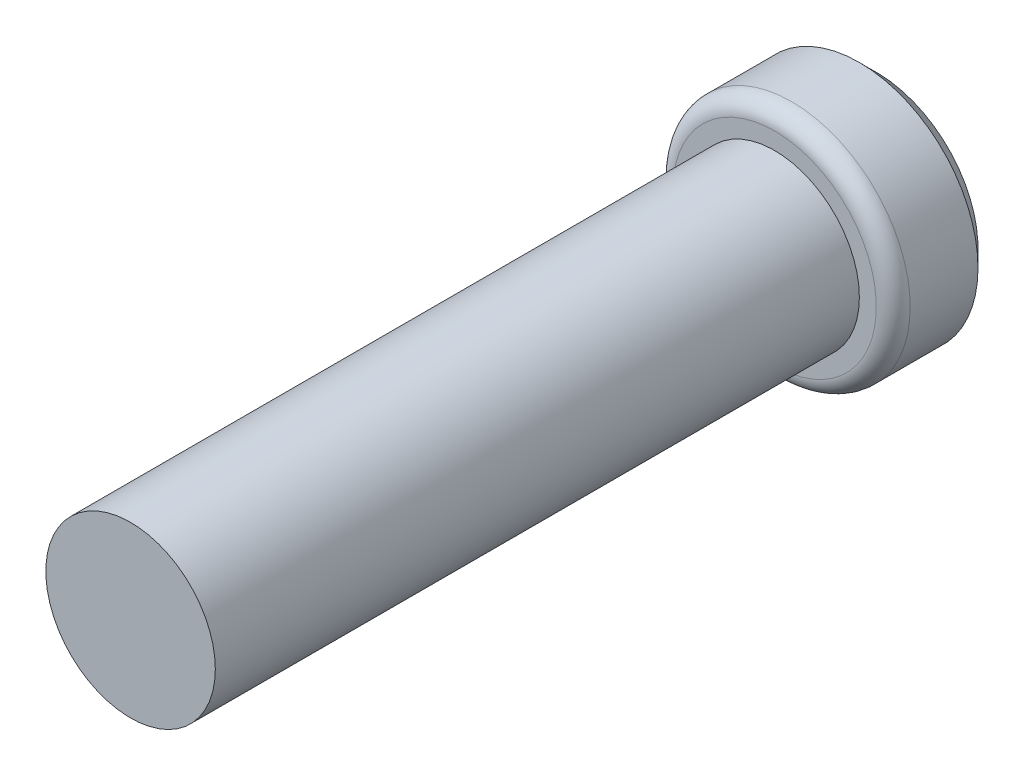
from build123d import *

# Parameters (mm, degrees)
SKETCH1_R           = 2.5
BOSS_EXTRUDE2_DEPTH = 19
SKETCH2_R           = 3.5
BOSS_EXTRUDE3_DEPTH = 3
CUT_EXTRUDE2_DEPTH  = 2
CHAMFER2_SIZE       = 0.5
FILLET5_R           = 0.5


with BuildPart() as part:
    # Sketch1 → Boss-Extrude2 (new body)
    with BuildSketch(Plane.XY):
        Circle(SKETCH1_R)
    extrude(amount=BOSS_EXTRUDE2_DEPTH)

    # Sketch2 → Boss-Extrude3 (add)
    with BuildSketch(Plane(origin=(0, 0, 0), x_dir=(-1, 0, 0), z_dir=(0, 0, -1))):
        Circle(SKETCH2_R)
    extrude(amount=BOSS_EXTRUDE3_DEPTH)

    # Sketch4 → Cut-Extrude2 (cut)
    with BuildSketch(Plane(origin=(0, 0, -3), x_dir=(-1, 0, 0), z_dir=(0, 0, -1))):
        Polygon((2.180058464, 0), (0, 0), (0, -2.517314682), (2.180058464, -1.258657341), align=None)
        Polygon((2.180058464, 1.258657341), (0, 2.517314682), (0, 0), (2.180058464, 0), align=None)
        Polygon((0, 0), (0, 2.517314682), (-2.180058464, 1.258657341), (-2.180058464, 0), align=None)
        Polygon((0, -2.517314682), (0, 0), (-2.180058464, 0), (-2.180058464, -1.258657341), align=None)
    extrude(amount=-CUT_EXTRUDE2_DEPTH, mode=Mode.SUBTRACT)

    # Chamfer2
    chamfer2_edges = [part.edges().sort_by_distance(p)[0] for p in [
        (3.5, 0, -3),
    ]]
    chamfer(chamfer2_edges, length=CHAMFER2_SIZE)

    # Fillet5
    fillet5_edges = [part.edges().sort_by_distance(p)[0] for p in [
        (3.5, 0, 0),
    ]]
    fillet(fillet5_edges, radius=FILLET5_R)


solid = part.part
